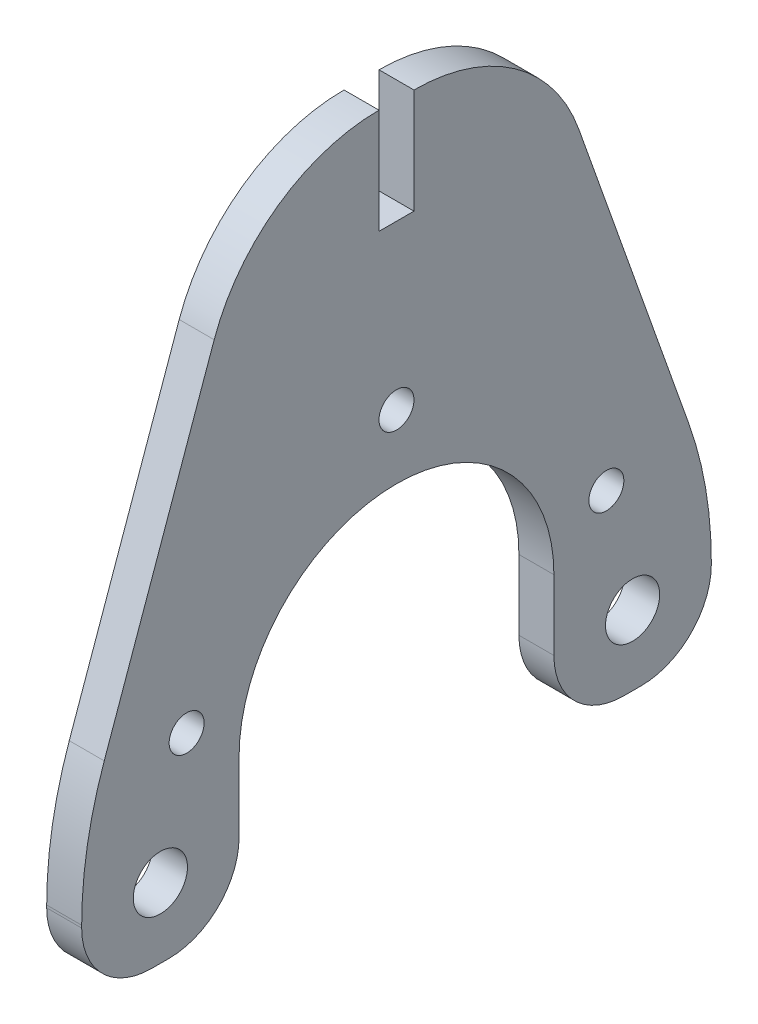
from build123d import *

# Parameters (mm, degrees)
BOSS_EXTRUDE1_DEPTH              = 3.175
F_10_0_1935_DIAMETER_HOLE1_D     = 4.9149
F_10_0_1935_DIAMETER_HOLE1_DEPTH = 19.001994
F_10_0_1935_DIAMETER_HOLE1_TIP   = 1.476584928
SKETCH4_R                        = 1.5875
CUT_EXTRUDE1_DEPTH               = 53.937829102
FILLET2_R                        = 35.56
FILLET1_R                        = 6.35


with BuildPart() as part:
    # Sketch1 → Boss-Extrude1 (new body)
    with BuildSketch(Plane(origin=(0, 0, 0), x_dir=(0, 0, -1), z_dir=(1, 0, 0))):
        with BuildLine():
            Line((1.5875, 44.45), (1.5875, 34.925))
            Line((1.5875, 34.925), (-1.5875, 34.925))
            Line((-1.5875, 34.925), (-1.5875, 44.45))
            ThreePointArc((-1.5875, 44.45), (-10.74499019, 41.54249777), (-16.548096362, 33.885007675))
            Line((-16.548096362, 33.885007675), (-28.575, 0))
            Line((-28.575, 0), (-28.575, -12.7))
            Line((-28.575, -12.7), (-14.2875, -12.7))
            Line((-14.2875, -12.7), (-14.2875, 0))
            ThreePointArc((-14.2875, 0), (0, 14.2875), (14.2875, 0))
            Line((14.2875, 0), (14.2875, -12.7))
            Line((14.2875, -12.7), (28.575, -12.7))
            Line((28.575, -12.7), (28.575, 0))
            Line((28.575, 0), (16.548096362, 33.885007675))
            ThreePointArc((16.548096362, 33.885007675), (10.74499019, 41.54249777), (1.5875, 44.45))
        make_face()
    extrude(amount=BOSS_EXTRUDE1_DEPTH)

    # #10 (0.1935) Diameter Hole1
    with Locations(Plane.ZY):
        with Locations((-21.43125, -6.35), (21.43125, -6.35)):
            Hole(F_10_0_1935_DIAMETER_HOLE1_D / 2, depth=F_10_0_1935_DIAMETER_HOLE1_DEPTH)
            with Locations((0, 0, -(F_10_0_1935_DIAMETER_HOLE1_DEPTH + F_10_0_1935_DIAMETER_HOLE1_TIP / 2))):  # 118° drill point
                Cone(0, F_10_0_1935_DIAMETER_HOLE1_D / 2, F_10_0_1935_DIAMETER_HOLE1_TIP, mode=Mode.SUBTRACT)

    # Sketch4 → Cut-Extrude1 (cut, through all)
    with BuildSketch(Plane(origin=(3.175, 0, 0), x_dir=(0, 0, -1), z_dir=(1, 0, 0))):
        with Locations((0, 20.09775)):
            Circle(SKETCH4_R)
        with Locations((-19.048871022, 4.22275)):
            Circle(SKETCH4_R)
        with Locations((19.048871022, 4.22275)):
            Circle(SKETCH4_R)
    extrude(amount=-CUT_EXTRUDE1_DEPTH, mode=Mode.SUBTRACT)

    # Fillet2
    fillet2_edges = [part.edges().sort_by_distance(p)[0] for p in [
        (1.5875, 0, 28.575),
        (1.5875, 0, -28.575),
    ]]
    fillet(fillet2_edges, radius=FILLET2_R)

    # Fillet1
    fillet1_edges = [part.edges().sort_by_distance(p)[0] for p in [
        (1.5875, -12.7, 14.2875),
        (1.5875, -12.7, 28.575),
        (1.5875, -12.7, -28.575),
        (1.5875, -12.7, -14.2875),
    ]]
    fillet(fillet1_edges, radius=FILLET1_R)


solid = part.part
